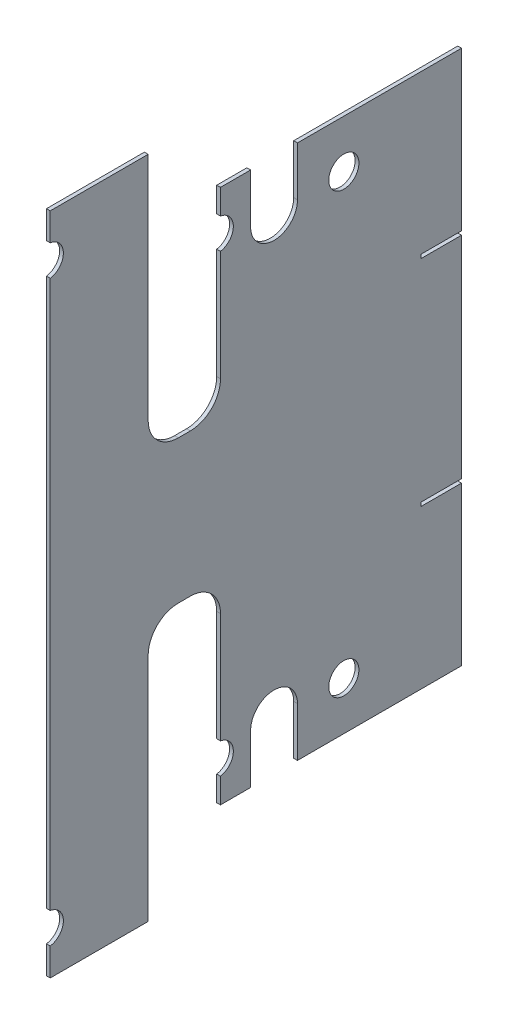
from build123d import *

# Parameters (mm, degrees)
SKETCH1_RX          = 12.847459174
SKETCH1_RY          = 12.7
BOSS_EXTRUDE1_DEPTH = 1.5875
SKETCH3_R           = 13.081
CUT_EXTRUDE1_DEPTH  = 118.1481
SKETCH4_R           = 13.081
CUT_EXTRUDE2_DEPTH  = 118.1481
FILLET1_R           = 25.4


with BuildPart() as part:
    # Sketch1 → Boss-Extrude1 (new, symmetric)
    with BuildSketch(Plane.ZY.offset(573.7606)):
        with BuildLine():
            Line((38.1, 225.425), (38.1, 183.869089605))
            ThreePointArc((38.1, 183.869089605), (18.348846559, 164.117936165), (-1.402306881, 183.869089605))
            Line((-1.402306881, 183.869089605), (-1.402306881, 225.425))
            Line((-1.402306881, 225.425), (-139.7, 225.425))
            Line((-139.7, 225.425), (-139.7, 92.075))
            Line((-139.7, 92.075), (-105.5624, 92.075))
            Line((-105.5624, 92.075), (-105.5624, 88.9))
            Line((-105.5624, 88.9), (-139.7, 88.9))
            Line((-139.7, 88.9), (-139.7, -88.9))
            Line((-139.7, -88.9), (-105.5624, -88.9))
            Line((-105.5624, -88.9), (-105.5624, -92.075))
            Line((-105.5624, -92.075), (-139.7, -92.075))
            Line((-139.7, -92.075), (-139.7, -225.425))
            Line((-139.7, -225.425), (-1.402306881, -225.425))
            Line((-1.402306881, -225.425), (-1.402306881, -183.869089605))
            ThreePointArc((-1.402306881, -183.869089605), (18.348846559, -164.117936165), (38.1, -183.869089605))
            Line((38.1, -183.869089605), (38.1, -225.425))
            Line((38.1, -225.425), (63.5, -225.425))
            Line((63.5, -225.425), (63.5, -60.325))
            Line((63.5, -60.325), (124.46, -60.325))
            Line((124.46, -60.325), (124.46, -280.035))
            Line((124.46, -280.035), (207.01, -280.035))
            Line((207.01, -280.035), (207.01, 280.035))
            Line((207.01, 280.035), (124.46, 280.035))
            Line((124.46, 280.035), (124.46, 60.325))
            Line((124.46, 60.325), (63.5, 60.325))
            Line((63.5, 60.325), (63.5, 225.425))
            Line((63.5, 225.425), (38.1, 225.425))
        make_face()
        with Locations(Location((-40.479630886, 184.911482002), (0, 0, 94.708027414))):
            Ellipse(SKETCH1_RX, SKETCH1_RY, mode=Mode.SUBTRACT)
        with Locations(Location((-40.479630886, -184.911482002), (0, 0, -94.708027414))):
            Ellipse(SKETCH1_RX, SKETCH1_RY, mode=Mode.SUBTRACT)
    extrude(amount=BOSS_EXTRUDE1_DEPTH, both=True)

    # Sketch3 → Cut-Extrude1 (cut)
    with BuildSketch(Plane(origin=(-457.2, 191.578892686, 65.734499214), x_dir=(0, 0, 1), z_dir=(-1, 0, 0))):
        Circle(SKETCH3_R)
    cut_extrude1 = extrude(amount=CUT_EXTRUDE1_DEPTH, mode=Mode.SUBTRACT)

    # Sketch4 → Cut-Extrude2 (cut)
    with BuildSketch(Plane(origin=(-457.2, 243.726115798, 209.007817696), x_dir=(0, 0, -1), z_dir=(1, 0, 0))):
        Circle(SKETCH4_R)
    cut_extrude2 = extrude(amount=-CUT_EXTRUDE2_DEPTH, mode=Mode.SUBTRACT)

    # Mirror1: Cut-Extrude1, Cut-Extrude2 across plane
    add(cut_extrude1.mirror(Plane.ZX), mode=Mode.SUBTRACT)
    add(cut_extrude2.mirror(Plane.ZX), mode=Mode.SUBTRACT)

    # Fillet1
    fillet1_edges = [part.edges().sort_by_distance(p)[0] for p in [
        (-573.7606, 60.325, 63.5),
        (-573.7606, 60.325, 124.46),
        (-573.7606, -60.325, 124.46),
        (-573.7606, -60.325, 63.5),
    ]]
    fillet(fillet1_edges, radius=FILLET1_R)


solid = part.part
